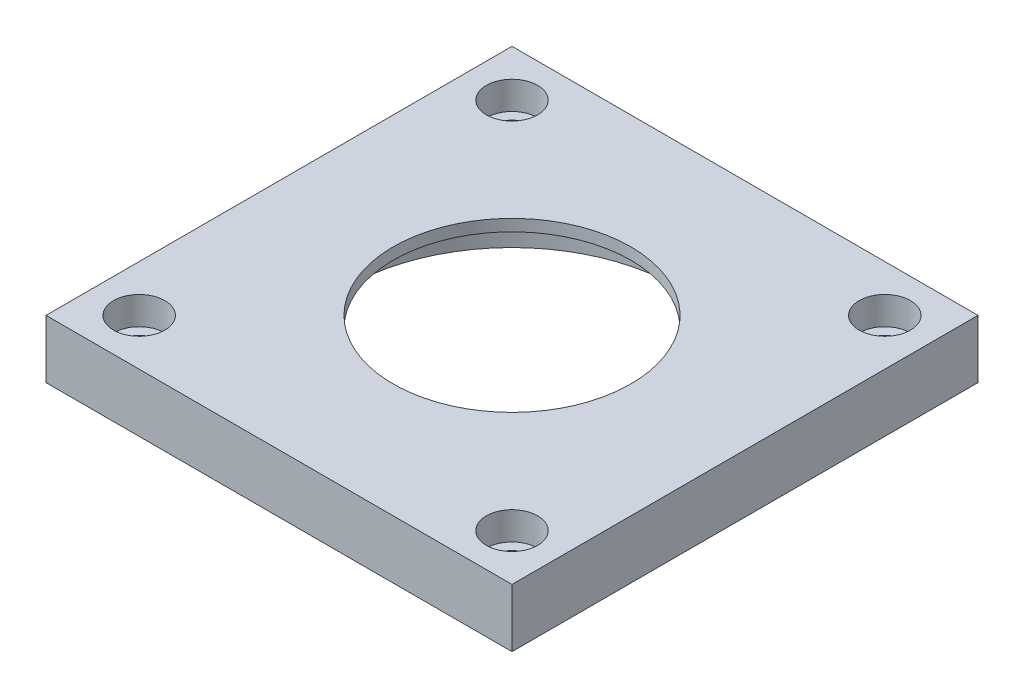
from build123d import *

# Parameters (mm, degrees)
CROQUIS1_W              = 100
CROQUIS1_H              = 100
SALIENTE_EXTRUIR1_DEPTH = 12.5
CROQUIS3_R              = 35.5
CORTAR_EXTRUIR1_DEPTH   = 10
CROQUIS4_R              = 25.5
CORTAR_EXTRUIR2_DEPTH   = 72.414284285
CROQUIS5_R              = 3.25
CORTAR_EXTRUIR3_DEPTH   = 72.807033082
MATRIZC1_COUNT          = 4
CROQUIS6_R              = 5.5
CORTAR_EXTRUIR4_DEPTH   = 6
MATRIZC2_COUNT          = 4


with BuildPart() as part:
    # Croquis1 → Saliente-Extruir1 (new body)
    with BuildSketch(Plane(origin=(0, 0, 0), x_dir=(1, 0, 0), z_dir=(0, 1, 0))):
        Rectangle(CROQUIS1_W, CROQUIS1_H)
    extrude(amount=SALIENTE_EXTRUIR1_DEPTH)

    # Croquis3 → Cortar-Extruir1 (cut)
    with BuildSketch(Plane.XZ):
        with Locations(Location((0, 0, 0), (0, 0, 270))):
            Circle(CROQUIS3_R)
    extrude(amount=-CORTAR_EXTRUIR1_DEPTH, mode=Mode.SUBTRACT)

    # Croquis4 → Cortar-Extruir2 (cut, through all)
    with BuildSketch(Plane.XZ.offset(-10)):
        with Locations(Location((0, 0, 0), (0, 0, 270))):
            Circle(CROQUIS4_R)
    extrude(amount=-CORTAR_EXTRUIR2_DEPTH, mode=Mode.SUBTRACT)

    # Croquis5 → Cortar-Extruir3 (cut, through all)
    with BuildSketch(Plane.XZ):
        with Locations(Location((-40, 40, 0), (0, 0, 270))):
            Circle(CROQUIS5_R)
    cortar_extruir3 = extrude(amount=-CORTAR_EXTRUIR3_DEPTH, mode=Mode.SUBTRACT)

    # MatrizC1: Cortar-Extruir3 ×4 about axis
    matrizc1_axis = Axis((0, 0, 0), (0, 1, 0))
    for i in range(1, MATRIZC1_COUNT):
        add(cortar_extruir3.rotate(matrizc1_axis, i * 360 / MATRIZC1_COUNT), mode=Mode.SUBTRACT)

    # Croquis6 → Cortar-Extruir4 (cut)
    with BuildSketch(Plane(origin=(0, 12.5, 0), x_dir=(1, 0, 0), z_dir=(0, 1, 0))):
        with Locations(Location((-40, 40, 0), (0, 0, 270))):
            Circle(CROQUIS6_R)
    cortar_extruir4 = extrude(amount=-CORTAR_EXTRUIR4_DEPTH, mode=Mode.SUBTRACT)

    # MatrizC2: Cortar-Extruir4 ×4 about axis
    matrizc2_axis = Axis((0, 0, 0), (0, 1, 0))
    for i in range(1, MATRIZC2_COUNT):
        add(cortar_extruir4.rotate(matrizc2_axis, i * 360 / MATRIZC2_COUNT), mode=Mode.SUBTRACT)


solid = part.part
